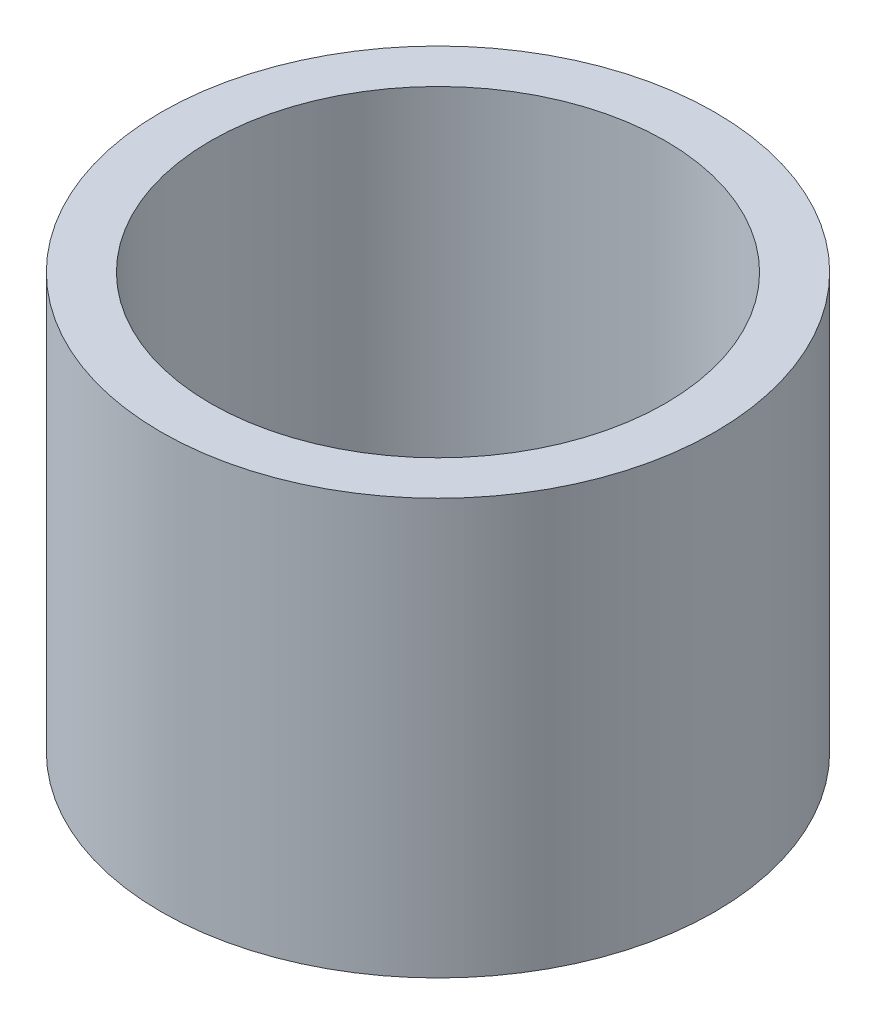
from build123d import *

# Parameters (mm, degrees)
SKETCH1_R           = 12.7
SKETCH1_R_2         = 10.4275
BOSS_EXTRUDE1_DEPTH = 19.05


with BuildPart() as part:
    # Sketch1 → Boss-Extrude1 (new body)
    with BuildSketch(Plane(origin=(0, 0, 0), x_dir=(1, 0, 0), z_dir=(0, 1, 0))):
        with Locations(Location((0, 0, 0), (0, 0, 90))):
            Circle(SKETCH1_R)
        with Locations(Location((0, 0, 0), (0, 0, 90))):
            Circle(SKETCH1_R_2, mode=Mode.SUBTRACT)
    extrude(amount=BOSS_EXTRUDE1_DEPTH)


solid = part.part
